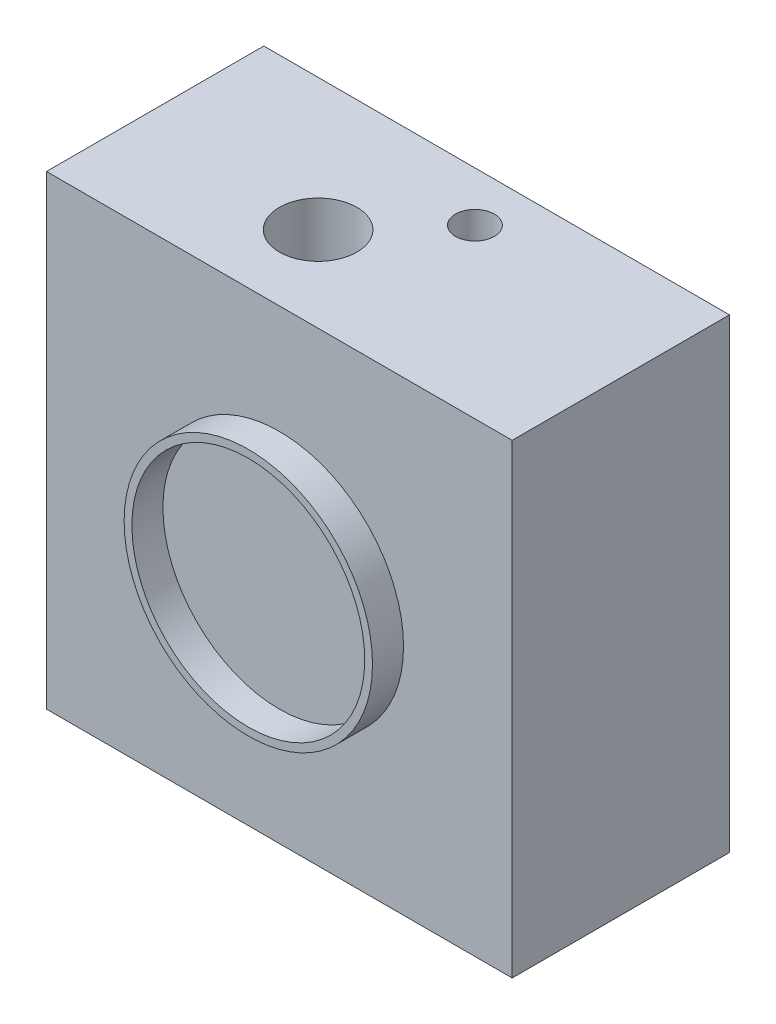
from build123d import *

# Parameters (mm, degrees)
SKETCH_1_W                = 30
SKETCH_1_H                = 30
EXTRUDE_1_DEPTH           = 14
SKETCH_2_R                = 8
SKETCH_2_R_2              = 7.5
EXTRUDE_2_DEPTH           = 2
SKETCH_3_R                = 2.5
CUT_EXTRUDE_1_DEPTH       = 15
HOLE_WIZARD_M3_1_D        = 2.5
HOLE_WIZARD_M3_1_DEPTH    = 7.5
HOLE_WIZARD_M3_1_TIP      = 0.751075774
HOLE_WIZARD_1_D           = 3
HOLE_WIZARD_1_DEPTH       = 9
HOLE_WIZARD_1_CBORE_D     = 6
HOLE_WIZARD_1_CBORE_DEPTH = 5


with BuildPart() as part:
    # 草图1 → 凸台-拉伸1 (new body)
    with BuildSketch(Plane.XY):
        Rectangle(SKETCH_1_W, SKETCH_1_H)
    extrude(amount=EXTRUDE_1_DEPTH)

    # 草图2 → 凸台-拉伸2 (add)
    with BuildSketch(Plane.XY.offset(14)):
        Circle(SKETCH_2_R)
        Circle(SKETCH_2_R_2, mode=Mode.SUBTRACT)
    extrude(amount=EXTRUDE_2_DEPTH)

    # 草图3 → 切除-拉伸1 (cut)
    with BuildSketch(Plane(origin=(0, 15, 0), x_dir=(1, 0, 0), z_dir=(0, 1, 0))):
        with Locations(Location((-3, -8.5, 0), (0, 0, 270))):
            Circle(SKETCH_3_R)
    extrude(amount=-CUT_EXTRUDE_1_DEPTH, mode=Mode.SUBTRACT)

    # M3 螺纹孔1
    with Locations(Plane(origin=(1.8, 15, 3.2), x_dir=(0, 0, 1), z_dir=(0, 1, 0))):
        with Locations((0, 0)):
            Hole(HOLE_WIZARD_M3_1_D / 2, depth=HOLE_WIZARD_M3_1_DEPTH)
            with Locations((0, 0, -(HOLE_WIZARD_M3_1_DEPTH + HOLE_WIZARD_M3_1_TIP / 2))):  # 118° drill point
                Cone(0, HOLE_WIZARD_M3_1_D / 2, HOLE_WIZARD_M3_1_TIP, mode=Mode.SUBTRACT)

    # 孔1
    with Locations(Plane(origin=(9, 8.916915074, 0), x_dir=(-1, 0, 0), z_dir=(0, 0, -1))):
        with Locations((0, 0), (18, 0.083084926), (18, -17.916915074), (0, -17.916915074)):
            CounterBoreHole(HOLE_WIZARD_1_D / 2, HOLE_WIZARD_1_CBORE_D / 2, HOLE_WIZARD_1_CBORE_DEPTH, depth=HOLE_WIZARD_1_DEPTH)


solid = part.part
